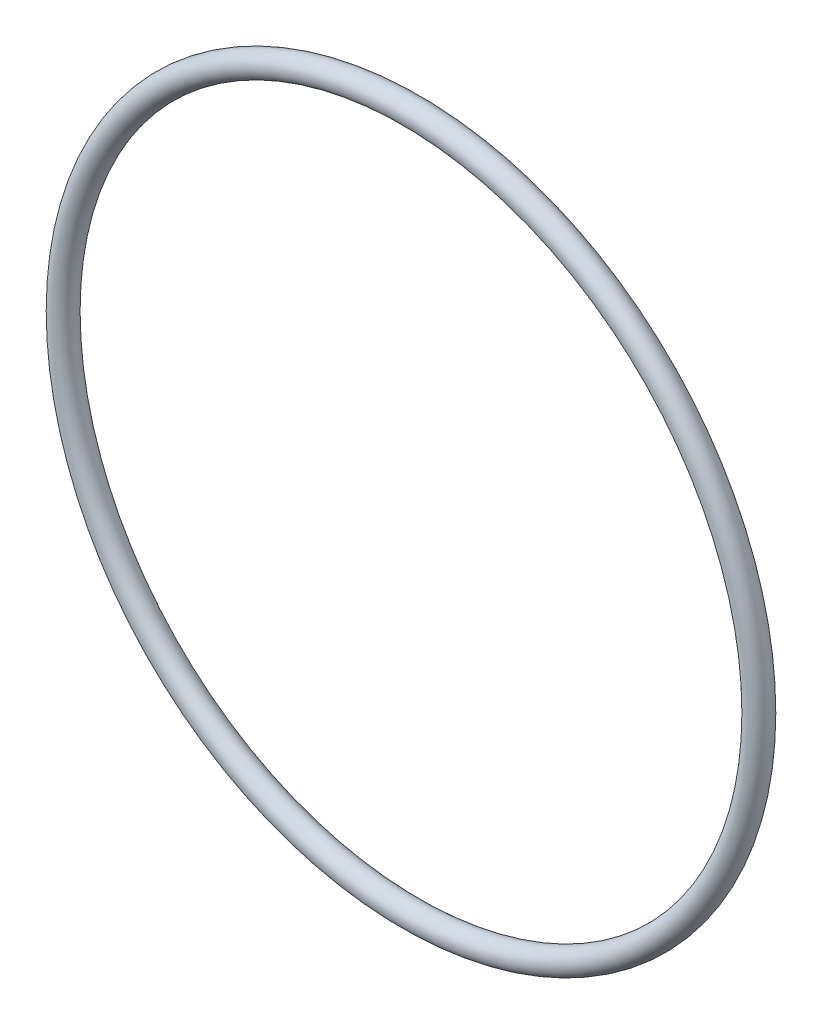
from build123d import *

# Parameters (mm, degrees)
ESQUISSE1_R = 1


with BuildPart() as part:
    # Esquisse1 → Révolution1 (revolve)
    with BuildSketch(Plane(origin=(0, 0, 0), x_dir=(0, 0, -1), z_dir=(1, 0, 0)), mode=Mode.PRIVATE) as r_volution1_sk:
        with Locations((0, 29)):
            Circle(ESQUISSE1_R)
    revolve(r_volution1_sk.sketch.rotate(Axis((0, 0, -88.99), (0, 0, 1)), 90), axis=Axis((0, 0, -88.99), (0, 0, 1)))


solid = part.part
